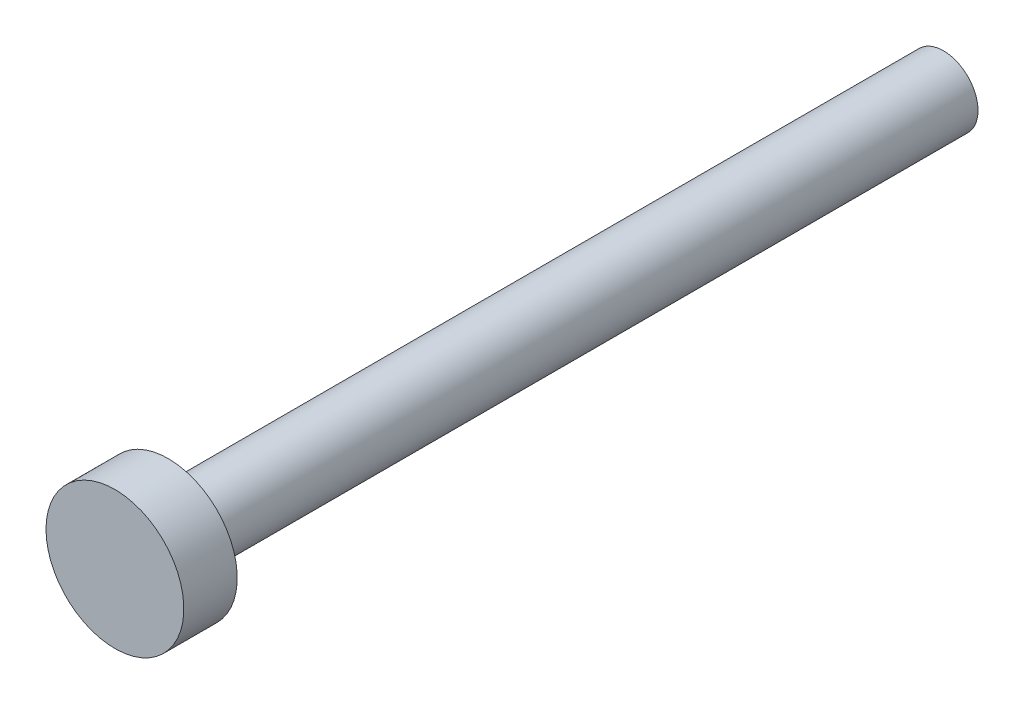
from build123d import *

# Parameters (mm, degrees)
ESQUISSE1_R        = 4
BOSS_EXTRU_1_DEPTH = 3.1
ESQUISSE2_R        = 2
BOSS_EXTRU_2_DEPTH = 45


with BuildPart() as part:
    # Esquisse1 → Boss.-Extru.1 (new body)
    with BuildSketch(Plane.XY):
        with Locations(Location((0, 0, 0), (0, 0, 180))):
            Circle(ESQUISSE1_R)
    extrude(amount=BOSS_EXTRU_1_DEPTH)

    # Esquisse2 → Boss.-Extru.2 (add)
    with BuildSketch(Plane(origin=(0, 0, 0), x_dir=(-1, 0, 0), z_dir=(0, 0, -1))):
        with Locations(Location((0, 0, 0), (0, 0, 180))):
            Circle(ESQUISSE2_R)
    extrude(amount=BOSS_EXTRU_2_DEPTH)


solid = part.part
